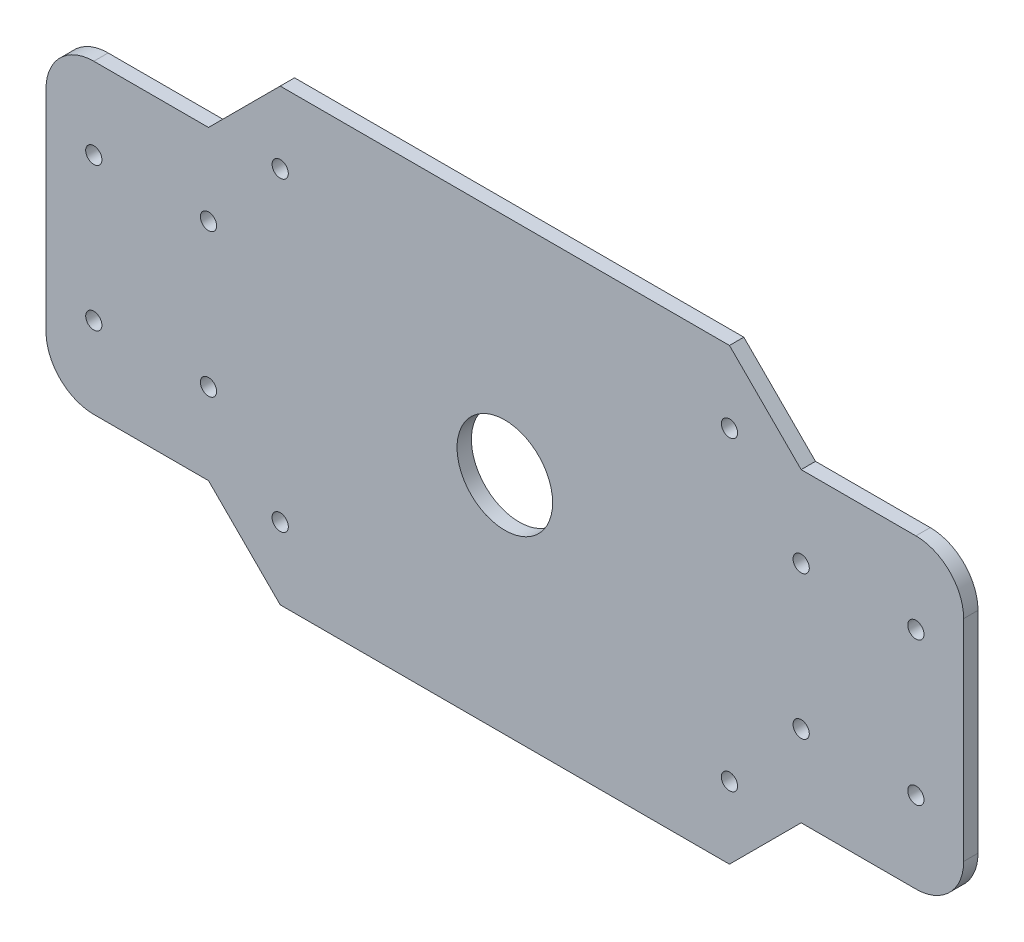
from build123d import *

# Parameters (mm, degrees)
SKETCH2_R           = 1.699999998
SKETCH2_R_2         = 1.699999999
SKETCH2_R_3         = 10
SKETCH2_R_4         = 1.7
BOSS_EXTRUDE4_DEPTH = 3


with BuildPart() as part:
    # Sketch2 → Boss-Extrude4 (new body)
    with BuildSketch(Plane.XY):
        with BuildLine():
            Line((-62, -14.549788982), (-47, 0.450211018))
            Line((-47, 0.450211018), (47, 0.450211018))
            Line((47, 0.450211018), (62, -14.549788982))
            Line((62, -14.549788982), (86, -14.549788982))
            ThreePointArc((86, -14.549788982), (93.071067812, -17.47872117), (96, -24.549788982))
            Line((96, -24.549788982), (96, -68.549788982))
            ThreePointArc((96, -68.549788982), (93.071067812, -75.620856793), (86, -78.549788982))
            Line((86, -78.549788982), (62, -78.549788982))
            Line((62, -78.549788982), (47, -93.549788982))
            Line((47, -93.549788982), (-47, -93.549788982))
            Line((-47, -93.549788982), (-62, -78.549788982))
            Line((-62, -78.549788982), (-86, -78.549788982))
            ThreePointArc((-86, -78.549788982), (-93.071067812, -75.620856793), (-96, -68.549788982))
            Line((-96, -68.549788982), (-96, -24.549788982))
            ThreePointArc((-96, -24.549788982), (-93.071067812, -17.47872117), (-86, -14.549788982))
            Line((-86, -14.549788982), (-62, -14.549788982))
        make_face()
        with Locations((-62, -31.549788982)):
            Circle(SKETCH2_R, mode=Mode.SUBTRACT)
        with Locations((-86, -31.549788982)):
            Circle(SKETCH2_R, mode=Mode.SUBTRACT)
        with Locations((-86, -61.549788982)):
            Circle(SKETCH2_R, mode=Mode.SUBTRACT)
        with Locations((-62, -61.549788982)):
            Circle(SKETCH2_R, mode=Mode.SUBTRACT)
        with Locations((86, -61.549788982)):
            Circle(SKETCH2_R_2, mode=Mode.SUBTRACT)
        with Locations((62, -61.549788982)):
            Circle(SKETCH2_R_2, mode=Mode.SUBTRACT)
        with Locations((86, -31.549788982)):
            Circle(SKETCH2_R_2, mode=Mode.SUBTRACT)
        with Locations((62, -31.549788982)):
            Circle(SKETCH2_R_2, mode=Mode.SUBTRACT)
        with Locations((0, -46.549788982)):
            Circle(SKETCH2_R_3, mode=Mode.SUBTRACT)
        with Locations((-47, -14.549788982)):
            Circle(SKETCH2_R_4, mode=Mode.SUBTRACT)
        with Locations((-47, -78.549788982)):
            Circle(SKETCH2_R_4, mode=Mode.SUBTRACT)
        with Locations((47, -78.549788982)):
            Circle(SKETCH2_R_4, mode=Mode.SUBTRACT)
        with Locations((47, -14.549788982)):
            Circle(SKETCH2_R_4, mode=Mode.SUBTRACT)
    extrude(amount=BOSS_EXTRUDE4_DEPTH)


solid = part.part
